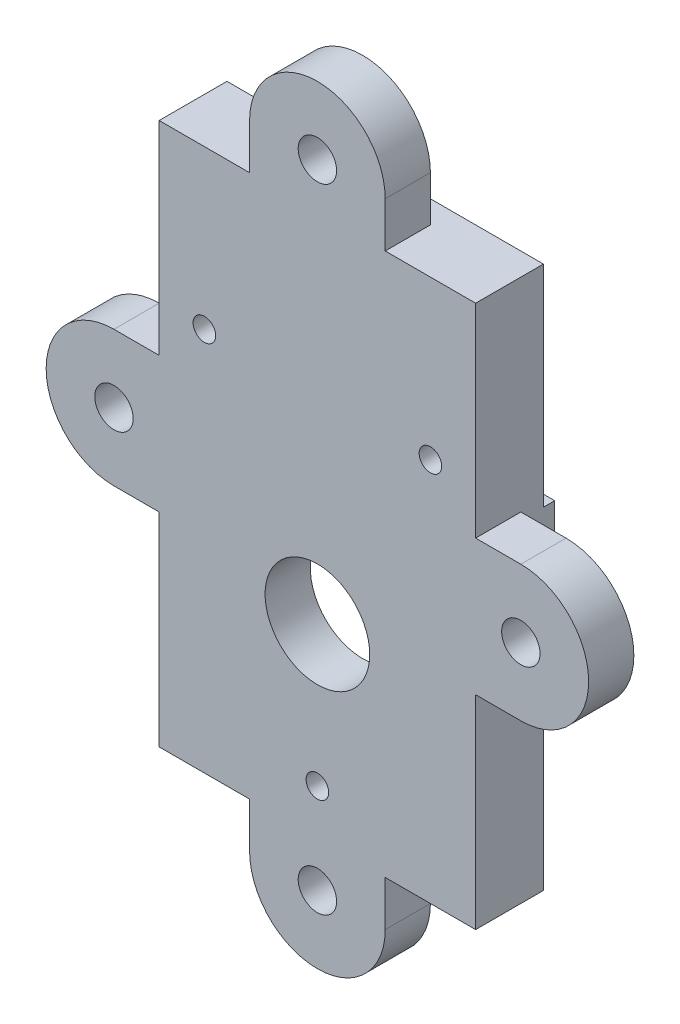
from build123d import *

# Parameters (mm, degrees)
SKETCH1_R           = 4.627548386
SKETCH1_R_2         = 1
BOSS_EXTRUDE1_DEPTH = 4
BOSS_EXTRUDE3_DEPTH = 2
SKETCH5_W           = 4.5
SKETCH5_H           = 3.78546494
BOSS_EXTRUDE4_DEPTH = 1
CUT_EXTRUDE1_DEPTH  = 47.280842529
D_GAGEMENT_M31_D    = 3.4


with BuildPart() as part:
    # Sketch1 → Boss-Extrude1 (new body)
    # profile 1 of 9: a face of its own
    with BuildSketch(Plane.XY):
        with BuildLine():
            Line((-6, 44), (-14, 44))
            Line((-14, 44), (-14, 26))
            Line((-14, 26), (-10, 26))
            ThreePointArc((-10, 26), (-4, 20), (-10, 14))
            Line((-10, 14), (-14, 14))
            Line((-14, 14), (-14, -4))
            Line((-14, -4), (-6, -4))
            Line((-6, -4), (-6, 0))
            ThreePointArc((-6, 0), (0, 6), (6, 0))
            Line((6, 0), (6, -4))
            Line((6, -4), (14, -4))
            Line((14, -4), (14, 14))
            Line((14, 14), (10, 14))
            ThreePointArc((10, 14), (4, 20), (10, 26))
            Line((10, 26), (14, 26))
            Line((14, 26), (14, 44))
            Line((14, 44), (6, 44))
            Line((6, 44), (6, 40))
            ThreePointArc((6, 40), (0, 34), (-6, 40))
            Line((-6, 40), (-6, 44))
        make_face()
        with Locations((0, 12.3952)):
            Circle(SKETCH1_R, mode=Mode.SUBTRACT)
        with Locations((-10, 30)):
            Circle(SKETCH1_R_2, mode=Mode.SUBTRACT)
        with Locations((10, 30)):
            Circle(SKETCH1_R_2, mode=Mode.SUBTRACT)
    # profile 2 of 9: a face of its own
    with BuildSketch(Plane.XY):
        with BuildLine():
            Line((-14, 14), (-14, 26))
            Line((-14, 26), (-18, 26))
            ThreePointArc((-18, 26), (-24, 20), (-18, 14))
            Line((-18, 14), (-14, 14))
        make_face()
    # profile 3 of 9: a face of its own
    with BuildSketch(Plane.XY):
        with BuildLine():
            Line((-10, 26), (-14, 26))
            Line((-14, 26), (-14, 14))
            Line((-14, 14), (-10, 14))
            ThreePointArc((-10, 14), (-4, 20), (-10, 26))
        make_face()
    # profile 4 of 9: a face of its own
    with BuildSketch(Plane.XY):
        with BuildLine():
            Line((6, 44), (-6, 44))
            Line((-6, 44), (-6, 40))
            ThreePointArc((-6, 40), (0, 34), (6, 40))
            Line((6, 40), (6, 44))
        make_face()
    # profile 5 of 9: a face of its own
    with BuildSketch(Plane.XY):
        with BuildLine():
            Line((-6, 48), (-6, 44))
            Line((-6, 44), (6, 44))
            Line((6, 44), (6, 48))
            ThreePointArc((6, 48), (0, 54), (-6, 48))
        make_face()
    # profile 6 of 9: a face of its own
    with BuildSketch(Plane.XY):
        with BuildLine():
            Line((14, 14), (14, 26))
            Line((14, 26), (10, 26))
            ThreePointArc((10, 26), (4, 20), (10, 14))
            Line((10, 14), (14, 14))
        make_face()
    # profile 7 of 9: a face of its own
    with BuildSketch(Plane.XY):
        with BuildLine():
            Line((18, 26), (14, 26))
            Line((14, 26), (14, 14))
            Line((14, 14), (18, 14))
            ThreePointArc((18, 14), (24, 20), (18, 26))
        make_face()
    # profile 8 of 9: a face of its own
    with BuildSketch(Plane.XY):
        with BuildLine():
            Line((-6, 0), (-6, -4))
            Line((-6, -4), (6, -4))
            Line((6, -4), (6, 0))
            ThreePointArc((6, 0), (0, 6), (-6, 0))
        make_face()
        Circle(SKETCH1_R_2, mode=Mode.SUBTRACT)
    # profile 9 of 9: a face of its own
    with BuildSketch(Plane.XY):
        with BuildLine():
            Line((6, -4), (-6, -4))
            Line((-6, -4), (-6, -8))
            ThreePointArc((-6, -8), (0, -14), (6, -8))
            Line((6, -8), (6, -4))
        make_face()
    extrude(amount=BOSS_EXTRUDE1_DEPTH)

    # Sketch4 → Boss-Extrude3 (add)
    with BuildSketch(Plane(origin=(0, 0, 0), x_dir=(-1, 0, 0), z_dir=(0, 0, -1))):
        Polygon((-6, 44), (-14, 44), (-14, 26), (-14, 14), (-14, -4), (-6, -4), (6, -4), (14, -4), (14, 14), (14, 26), (14, 44), (6, 44), align=None)
        with BuildLine():
            Line((-10.5, 32.449489743), (-10.5, 40.5))
            Line((-10.5, 40.5), (10.5, 40.5))
            Line((10.5, 40.5), (10.5, 32.449489743))
            ThreePointArc((10.5, 32.449489743), (11.936491673, 31.58113883), (12.5, 30))
            ThreePointArc((12.5, 30), (11.936491673, 28.41886117), (10.5, 27.550510257))
            Line((10.5, 27.550510257), (10.5, -0.5))
            Line((10.5, -0.5), (2.449489743, -0.5))
            ThreePointArc((2.449489743, -0.5), (0, -2.5), (-2.449489743, -0.5))
            Line((-2.449489743, -0.5), (-10.5, -0.5))
            Line((-10.5, -0.5), (-10.5, 27.550510257))
            ThreePointArc((-10.5, 27.550510257), (-12.5, 30), (-10.5, 32.449489743))
        make_face(mode=Mode.SUBTRACT)
    extrude(amount=BOSS_EXTRUDE3_DEPTH)

    # Sketch5 → Boss-Extrude4 (add)
    with BuildSketch(Plane(origin=(0, 0, -2), x_dir=(-1, 0, 0), z_dir=(0, 0, -1))):
        with Locations((-11.75, 23.476244976)):
            Rectangle(SKETCH5_W, SKETCH5_H)
        with Locations((11.75, 23.476244976)):
            Rectangle(SKETCH5_W, SKETCH5_H)
    extrude(amount=BOSS_EXTRUDE4_DEPTH)

    # Sketch7 → Cut-Extrude1 (cut, through all)
    with BuildSketch(Plane(origin=(0, 25.368977446, 0), x_dir=(1, 0, 0), z_dir=(0, 1, 0))):
        Polygon((-10.5, 2), (-9.5, 3), (-9.5, 2), align=None)
        Polygon((10.5, 2), (9.5, 3), (9.5, 2), align=None)
    extrude(amount=-CUT_EXTRUDE1_DEPTH, mode=Mode.SUBTRACT)

    # Dégagement M31 (through all)
    with Locations(Plane.XY.offset(4)):
        with Locations((0, 48), (0, -8), (-18, 20), (18, 20)):
            Hole(D_GAGEMENT_M31_D / 2)


solid = part.part
